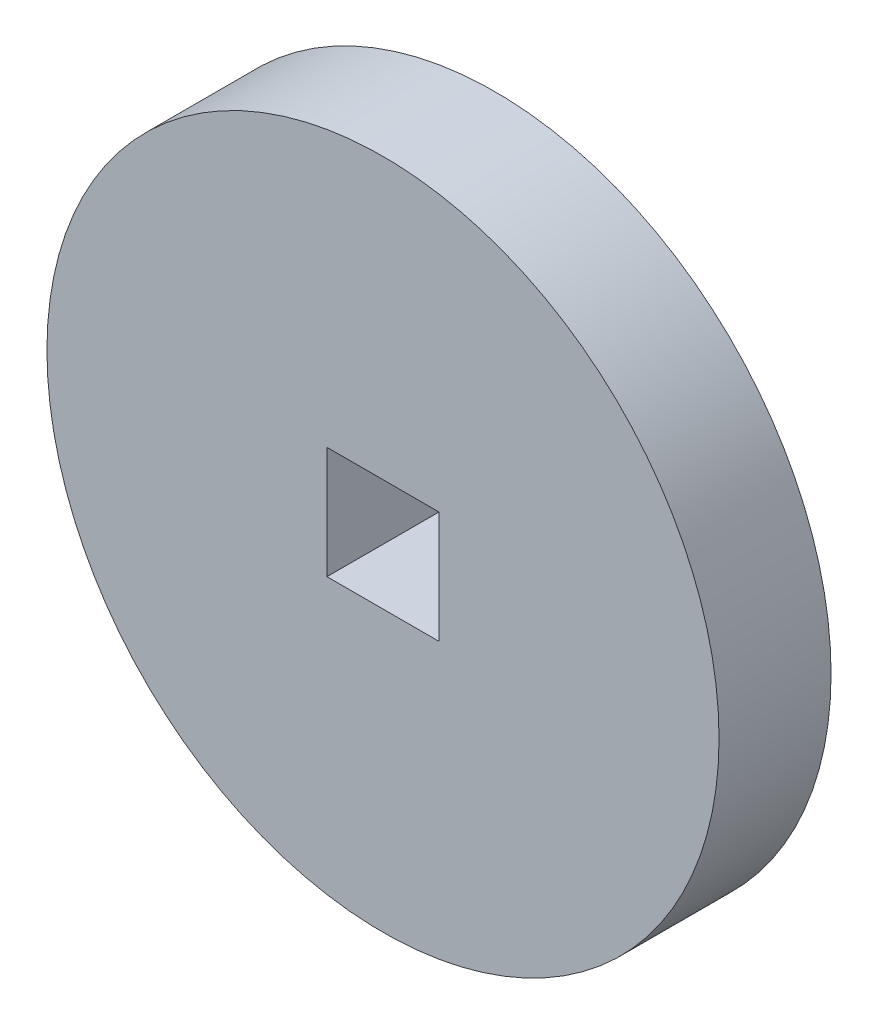
from build123d import *

# Parameters (mm, degrees)
SKETCH1_R           = 30
BOSS_EXTRUDE1_DEPTH = 10
SKETCH2_W           = 10
SKETCH2_H           = 10
CUT_EXTRUDE2_DEPTH  = 44.588989435


with BuildPart() as part:
    # Sketch1 → Boss-Extrude1 (new body)
    with BuildSketch(Plane.XY):
        Circle(SKETCH1_R)
    extrude(amount=-BOSS_EXTRUDE1_DEPTH)

    # Sketch2 → Cut-Extrude2 (cut, through all)
    with BuildSketch(Plane.XY):
        Rectangle(SKETCH2_W, SKETCH2_H)
    extrude(amount=-CUT_EXTRUDE2_DEPTH, mode=Mode.SUBTRACT)


solid = part.part
